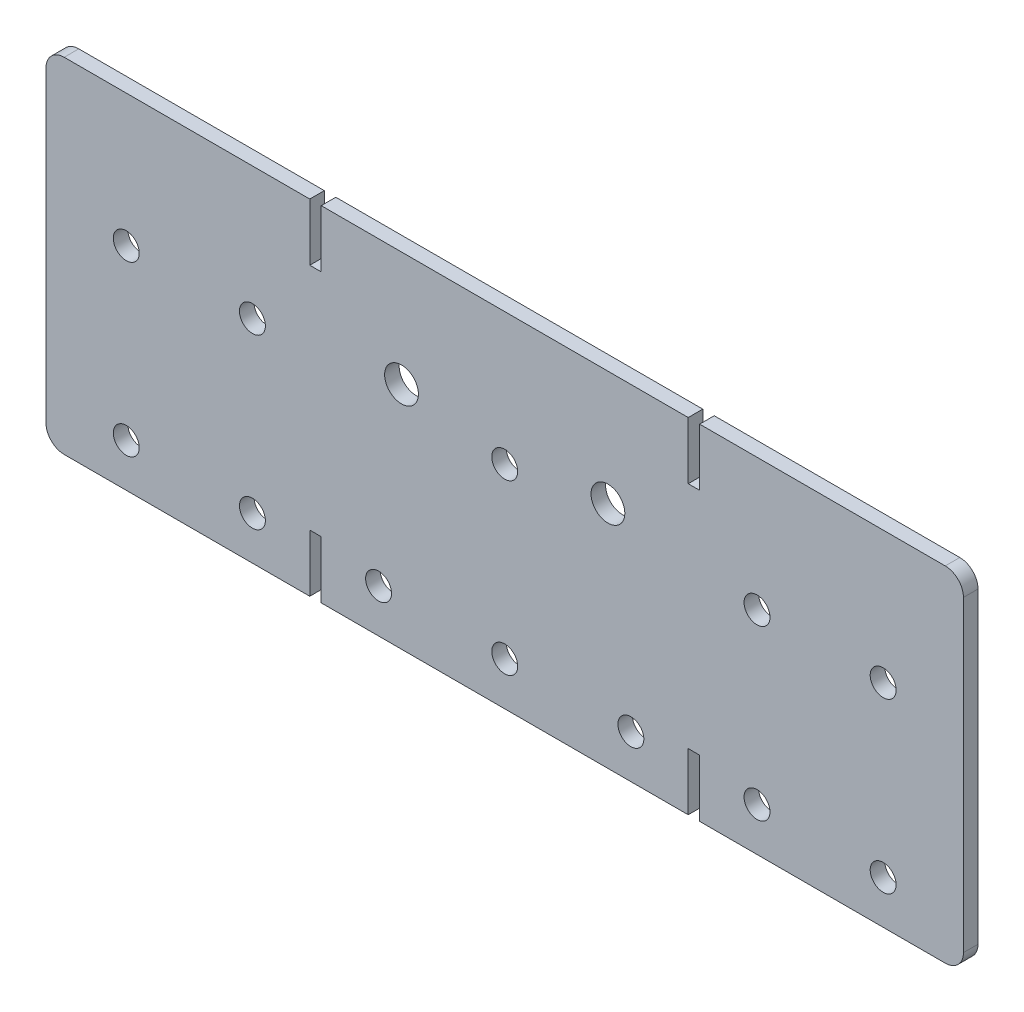
from build123d import *

# Parameters (mm, degrees)
SKETCH1_R           = 1.1303
SKETCH1_R_2         = 1.4732
BOSS_EXTRUDE1_DEPTH = 1.27
FILLET1_R           = 1.5875


with BuildPart() as part:
    # Sketch1 → Boss-Extrude1 (new body)
    with BuildSketch(Plane.XY):
        Polygon((23, 0), (0, 0), (0, -30), (23, -30), (23, -25), (24, -25), (24, -30), (56, -30), (56, -25), (57, -25), (57, -30), (80, -30), (80, 0), (57, 0), (57, -5), (56, -5), (56, 0), (24, 0), (24, -5), (23, -5), align=None)
        with Locations((7, -26.225)):
            Circle(SKETCH1_R, mode=Mode.SUBTRACT)
        with Locations((18, -26.225)):
            Circle(SKETCH1_R, mode=Mode.SUBTRACT)
        with Locations((29, -26.225)):
            Circle(SKETCH1_R, mode=Mode.SUBTRACT)
        with Locations((40, -26.225)):
            Circle(SKETCH1_R, mode=Mode.SUBTRACT)
        with Locations((51, -26.225)):
            Circle(SKETCH1_R, mode=Mode.SUBTRACT)
        with Locations((62, -26.225)):
            Circle(SKETCH1_R, mode=Mode.SUBTRACT)
        with Locations((73, -26.225)):
            Circle(SKETCH1_R, mode=Mode.SUBTRACT)
        with Locations((7, -11.525)):
            Circle(SKETCH1_R, mode=Mode.SUBTRACT)
        with Locations((18, -11.525)):
            Circle(SKETCH1_R, mode=Mode.SUBTRACT)
        with Locations((31, -10)):
            Circle(SKETCH1_R_2, mode=Mode.SUBTRACT)
        with Locations((40, -11.525)):
            Circle(SKETCH1_R, mode=Mode.SUBTRACT)
        with Locations((49, -10)):
            Circle(SKETCH1_R_2, mode=Mode.SUBTRACT)
        with Locations((62, -11.525)):
            Circle(SKETCH1_R, mode=Mode.SUBTRACT)
        with Locations((73, -11.525)):
            Circle(SKETCH1_R, mode=Mode.SUBTRACT)
    extrude(amount=BOSS_EXTRUDE1_DEPTH)

    # Fillet1
    fillet1_edges = [part.edges().sort_by_distance(p)[0] for p in [
        (0, -30, 0.635),
        (0, 0, 0.635),
        (80, 0, 0.635),
        (80, -30, 0.635),
    ]]
    fillet(fillet1_edges, radius=FILLET1_R)


solid = part.part
